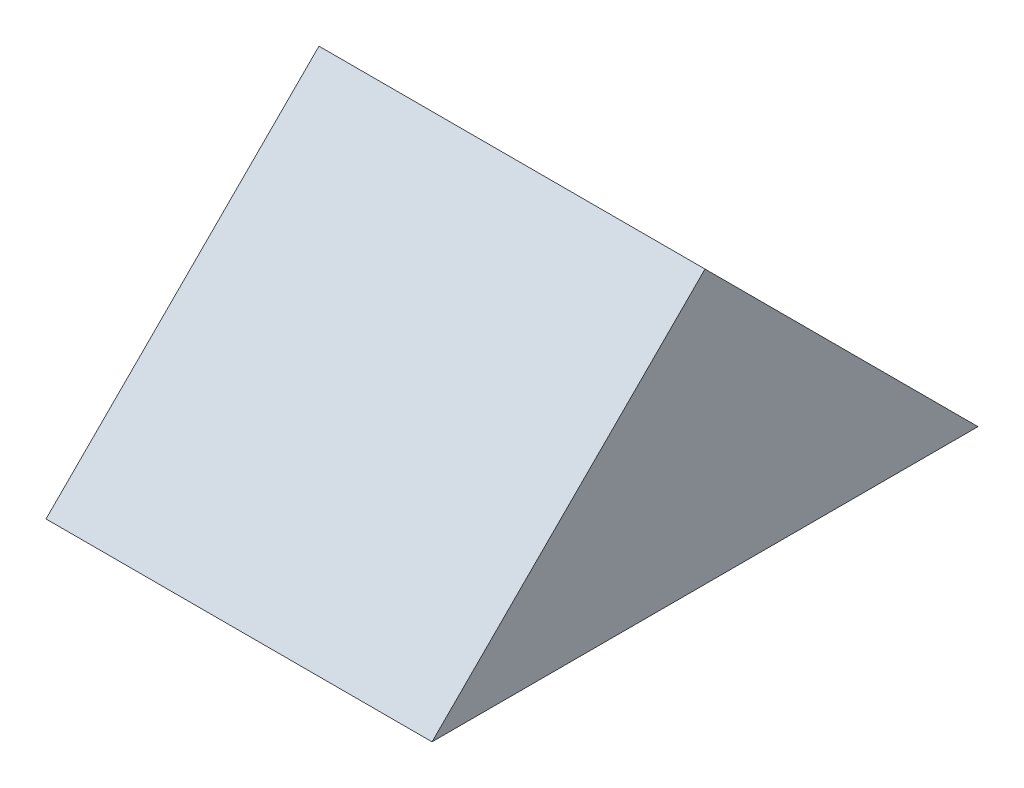
from build123d import *

# Parameters (mm, degrees)
EXTRUDE_3_DEPTH      = 15
EXTRUDE_3_DEPTH_BACK = 15


with BuildPart() as part:
    # Эскиз1 → Бобышка-Вытянуть3 (new, two sides: drawn at the far end of the back side and taken through both)
    with BuildSketch(Plane(origin=(0, 0, 0), x_dir=(0, 0, -1), z_dir=(1, 0, 0)).offset(-EXTRUDE_3_DEPTH_BACK)):
        Polygon((0, 21.213203436), (-21.213203436, 0), (21.213203436, 0), align=None)
    extrude(amount=EXTRUDE_3_DEPTH + EXTRUDE_3_DEPTH_BACK)


solid = part.part
